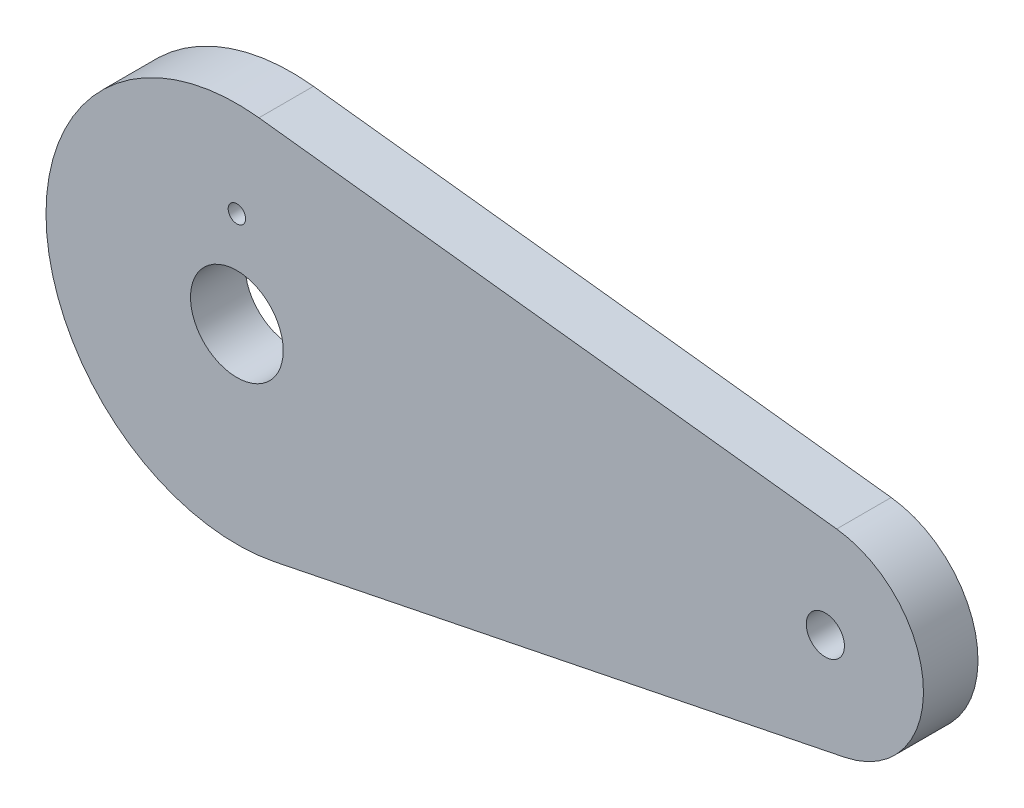
from build123d import *

# Parameters (mm, degrees)
SKETCH1_R           = 4.25
SKETCH1_R_2         = 1.75
SKETCH1_R_3         = 0.8
BOSS_EXTRUDE1_DEPTH = 5


with BuildPart() as part:
    # Sketch1 → Boss-Extrude1 (new body)
    with BuildSketch(Plane.XY):
        with BuildLine():
            Line((-18.197591032, 74.9627461), (34.771929891, 68.799966437))
            ThreePointArc((34.771929891, 68.799966437), (42.723806159, 60.240313183), (35.522543907, 51.040214163))
            Line((35.522543907, 51.040214163), (-16.738063779, 40.429894456))
            ThreePointArc((-16.738063779, 40.429894456), (-37.7043906, 56.841024116), (-18.197591032, 74.9627461))
        make_face()
        with Locations((-20.22, 57.58)):
            Circle(SKETCH1_R, mode=Mode.SUBTRACT)
        with Locations((33.73183385, 59.860268443)):
            Circle(SKETCH1_R_2, mode=Mode.SUBTRACT)
        with Locations((-20.22, 66.33)):
            Circle(SKETCH1_R_3, mode=Mode.SUBTRACT)
    extrude(amount=-BOSS_EXTRUDE1_DEPTH)


solid = part.part
